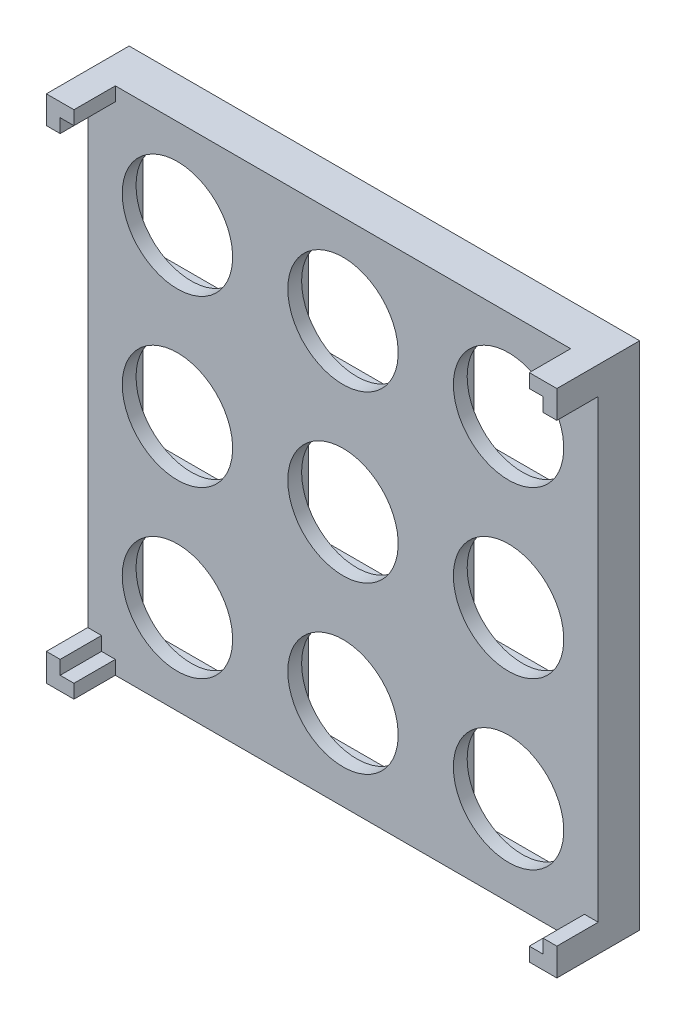
from build123d import *

# Parameters (mm, degrees)
SKETCH5_W           = 185
SKETCH5_H           = 185
BOSS_EXTRUDE5_DEPTH = 30
SKETCH6_W           = 55
SKETCH6_H           = 55
CUT_EXTRUDE2_DEPTH  = 10
SKETCH7_R           = 20
CUT_EXTRUDE3_DEPTH  = 167.353137545
SKETCH8_W           = 175
SKETCH8_H           = 175
CUT_EXTRUDE4_DEPTH  = 15
SKETCH9_W           = 165
SKETCH9_H           = 15
CUT_EXTRUDE6_DEPTH  = 225.262725022
SKETCH11_W          = 15
SKETCH11_H          = 165
CUT_EXTRUDE7_DEPTH  = 218.323713701


with BuildPart() as part:
    # Sketch5 → Boss-Extrude5 (new body)
    with BuildSketch(Plane.XY):
        with Locations((30.661559889, 17.520891365)):
            Rectangle(SKETCH5_W, SKETCH5_H)
    extrude(amount=BOSS_EXTRUDE5_DEPTH)

    # Sketch6 → Cut-Extrude2 (cut)
    with BuildSketch(Plane(origin=(0, 0, 0), x_dir=(-1, 0, 0), z_dir=(0, 0, -1))):
        with Locations((29.338440111, 17.520891365)):
            Rectangle(SKETCH6_W, SKETCH6_H)
        with Locations((29.338440111, -42.479108635)):
            Rectangle(SKETCH6_W, SKETCH6_H)
        with Locations((-30.661559889, -42.479108635)):
            Rectangle(SKETCH6_W, SKETCH6_H)
        with Locations((-30.661559889, 17.520891365)):
            Rectangle(SKETCH6_W, SKETCH6_H)
        with Locations((-30.661559889, 77.520891365)):
            Rectangle(SKETCH6_W, SKETCH6_H)
        with Locations((-90.661559889, 77.520891365)):
            Rectangle(SKETCH6_W, SKETCH6_H)
        with Locations((-90.661559889, 17.520891365)):
            Rectangle(SKETCH6_W, SKETCH6_H)
        with Locations((-90.661559889, -42.479108635)):
            Rectangle(SKETCH6_W, SKETCH6_H)
        with Locations((29.338440111, 77.520891365)):
            Rectangle(SKETCH6_W, SKETCH6_H)
    extrude(amount=-CUT_EXTRUDE2_DEPTH, mode=Mode.SUBTRACT)

    # Sketch7 → Cut-Extrude3 (cut, through all)
    with BuildSketch(Plane(origin=(0, 0, 10), x_dir=(-1, 0, 0), z_dir=(0, 0, -1))):
        with Locations((-90.661559889, 77.520891365)):
            Circle(SKETCH7_R)
        with Locations((-30.661559889, 77.520891365)):
            Circle(SKETCH7_R)
        with Locations((29.338440111, 77.520891365)):
            Circle(SKETCH7_R)
        with Locations((29.338440111, 17.520891365)):
            Circle(SKETCH7_R)
        with Locations((-30.661559889, 17.520891365)):
            Circle(SKETCH7_R)
        with Locations((-90.661559889, 17.520891365)):
            Circle(SKETCH7_R)
        with Locations((29.338440111, -42.479108635)):
            Circle(SKETCH7_R)
        with Locations((-90.661559889, -42.479108635)):
            Circle(SKETCH7_R)
        with Locations((-30.661559889, -42.479108635)):
            Circle(SKETCH7_R)
    extrude(amount=-CUT_EXTRUDE3_DEPTH, mode=Mode.SUBTRACT)

    # Sketch8 → Cut-Extrude4 (cut)
    with BuildSketch(Plane.XY.offset(30)):
        with Locations((30.661559889, 17.520891365)):
            Rectangle(SKETCH8_W, SKETCH8_H)
    extrude(amount=-CUT_EXTRUDE4_DEPTH, mode=Mode.SUBTRACT)

    # Sketch9 → Cut-Extrude6 (cut, through all)
    with BuildSketch(Plane(origin=(0, 110.020891365, 0), x_dir=(1, 0, 0), z_dir=(0, 1, 0))):
        with Locations((30.661559889, -22.5)):
            Rectangle(SKETCH9_W, SKETCH9_H)
    extrude(amount=-CUT_EXTRUDE6_DEPTH, mode=Mode.SUBTRACT)

    # Sketch11 → Cut-Extrude7 (cut, through all)
    with BuildSketch(Plane.ZY.offset(61.838440111)):
        with Locations((22.5, 17.520891365)):
            Rectangle(SKETCH11_W, SKETCH11_H)
    extrude(amount=-CUT_EXTRUDE7_DEPTH, mode=Mode.SUBTRACT)


solid = part.part
